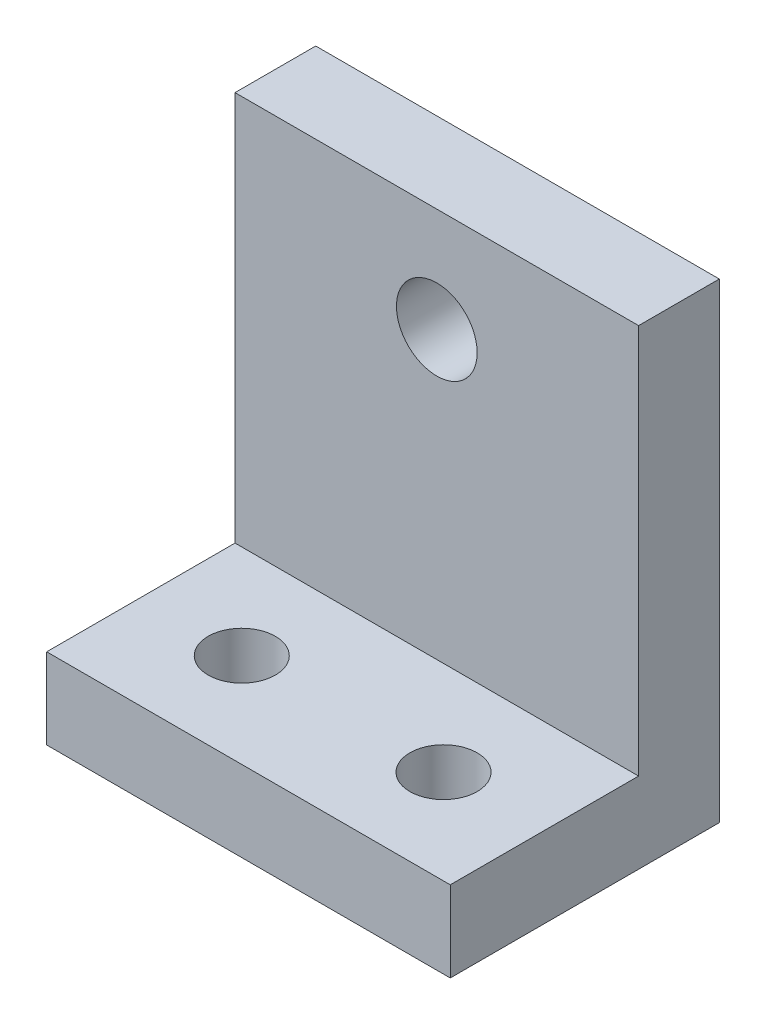
from build123d import *

# Parameters (mm, degrees)
CROQUIS1_W              = 30
CROQUIS1_H              = 20
SALIENTE_EXTRUIR1_DEPTH = 6
CROQUIS2_W              = 30
CROQUIS2_H              = 35
SALIENTE_EXTRUIR2_DEPTH = 6
CROQUIS3_R              = 3
CORTAR_EXTRUIR1_DEPTH   = 6
CROQUIS4_R              = 2.5
CORTAR_EXTRUIR2_DEPTH   = 6


with BuildPart() as part:
    # Croquis1 → Saliente-Extruir1 (new body)
    with BuildSketch(Plane(origin=(0, 0, 0), x_dir=(1, 0, 0), z_dir=(0, 1, 0))):
        Rectangle(CROQUIS1_W, CROQUIS1_H)
    extrude(amount=SALIENTE_EXTRUIR1_DEPTH)

    # Croquis2 → Saliente-Extruir2 (add)
    with BuildSketch(Plane(origin=(0, 0, -10), x_dir=(-1, 0, 0), z_dir=(0, 0, -1))):
        with Locations((0, 17.5)):
            Rectangle(CROQUIS2_W, CROQUIS2_H)
    extrude(amount=-SALIENTE_EXTRUIR2_DEPTH)

    # Croquis3 → Cortar-Extruir1 (cut)
    with BuildSketch(Plane.XY.offset(-4)):
        with Locations((0, 27.25)):
            Circle(CROQUIS3_R)
    extrude(amount=-CORTAR_EXTRUIR1_DEPTH, mode=Mode.SUBTRACT)

    # Croquis4 → Cortar-Extruir2 (cut)
    with BuildSketch(Plane(origin=(0, 6, 0), x_dir=(1, 0, 0), z_dir=(0, 1, 0))):
        with Locations(Location((-7.5, -3, 0), (0, 0, 270))):
            Circle(CROQUIS4_R)
        with Locations(Location((7.5, -3, 0), (0, 0, 270))):
            Circle(CROQUIS4_R)
    extrude(amount=-CORTAR_EXTRUIR2_DEPTH, mode=Mode.SUBTRACT)


solid = part.part
